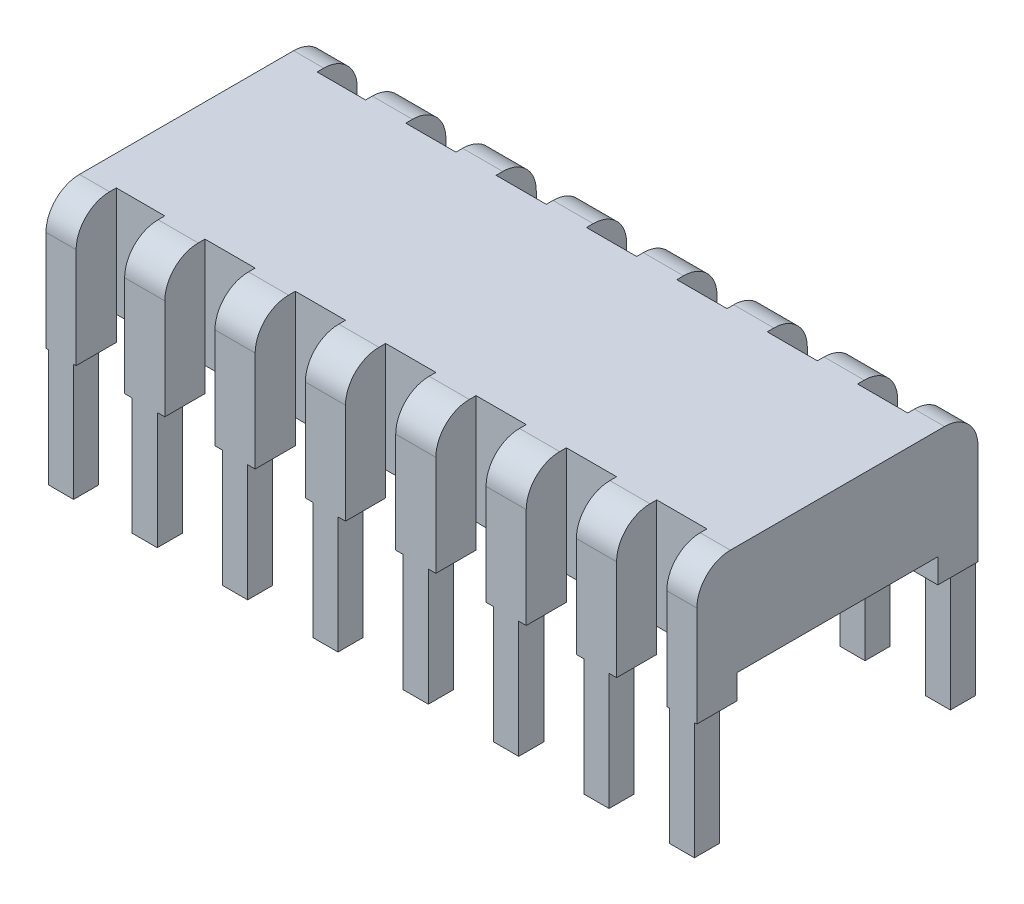
from build123d import *

# Parameters (mm, degrees)
SKETCH1_W           = 19.45
SKETCH1_H           = 6
BOSS_EXTRUDE1_DEPTH = 3.27
SKETCH2_W           = 0.9
SKETCH2_H           = 1.2
SKETCH2_W_2         = 1.2
BOSS_EXTRUDE2_DEPTH = 4
FILLET1_R           = 1
SKETCH3_W           = 0.75
SKETCH3_H           = 0.75
BOSS_EXTRUDE3_DEPTH = 3.5


with BuildPart() as part:
    # Sketch1 → Boss-Extrude1 (new body)
    with BuildSketch(Plane(origin=(0, 0, 0), x_dir=(1, 0, 0), z_dir=(0, 1, 0))):
        with Locations((9.725, 3)):
            Rectangle(SKETCH1_W, SKETCH1_H)
    extrude(amount=BOSS_EXTRUDE1_DEPTH)

    # Sketch2 → Boss-Extrude2 (add)
    with BuildSketch(Plane(origin=(0, 3.27, 0), x_dir=(1, 0, 0), z_dir=(0, 1, 0))):
        with Locations((19, -0.6)):
            Rectangle(SKETCH2_W, SKETCH2_H)
        with Locations((16.45, -0.6)):
            Rectangle(SKETCH2_W_2, SKETCH2_H)
        with Locations((13.75, -0.6)):
            Rectangle(SKETCH2_W_2, SKETCH2_H)
        with Locations((11.05, -0.6)):
            Rectangle(SKETCH2_W_2, SKETCH2_H)
        with Locations((8.35, -0.6)):
            Rectangle(SKETCH2_W_2, SKETCH2_H)
        with Locations((5.65, -0.6)):
            Rectangle(SKETCH2_W_2, SKETCH2_H)
        with Locations((2.95, -0.6)):
            Rectangle(SKETCH2_W_2, SKETCH2_H)
        with Locations((0.45, -0.6)):
            Rectangle(SKETCH2_W, SKETCH2_H)
        with Locations((0.45, 6.6)):
            Rectangle(SKETCH2_W, SKETCH2_H)
        with Locations((2.95, 6.6)):
            Rectangle(SKETCH2_W_2, SKETCH2_H)
        with Locations((5.65, 6.6)):
            Rectangle(SKETCH2_W_2, SKETCH2_H)
        with Locations((8.35, 6.6)):
            Rectangle(SKETCH2_W_2, SKETCH2_H)
        with Locations((11.05, 6.6)):
            Rectangle(SKETCH2_W_2, SKETCH2_H)
        with Locations((13.75, 6.6)):
            Rectangle(SKETCH2_W_2, SKETCH2_H)
        with Locations((16.45, 6.6)):
            Rectangle(SKETCH2_W_2, SKETCH2_H)
        with Locations((19, 6.6)):
            Rectangle(SKETCH2_W, SKETCH2_H)
    extrude(amount=-BOSS_EXTRUDE2_DEPTH)

    # Fillet1
    fillet1_edges = [part.edges().sort_by_distance(p)[0] for p in [
        (0.45, 3.27, 1.2),
        (0.45, 3.27, -7.2),
        (2.95, 3.27, -7.2),
        (5.65, 3.27, -7.2),
        (8.35, 3.27, -7.2),
        (19, 3.27, 1.2),
        (11.05, 3.27, -7.2),
        (13.75, 3.27, -7.2),
        (16.45, 3.27, -7.2),
        (19, 3.27, -7.2),
        (16.45, 3.27, 1.2),
        (13.75, 3.27, 1.2),
        (11.05, 3.27, 1.2),
        (8.35, 3.27, 1.2),
        (5.65, 3.27, 1.2),
        (2.95, 3.27, 1.2),
    ]]
    fillet(fillet1_edges, radius=FILLET1_R)

    # Sketch3 → Boss-Extrude3 (add)
    with BuildSketch(Plane.XZ.offset(0.73)):
        with Locations((19, 0.825)):
            Rectangle(SKETCH3_W, SKETCH3_H)
        with Locations((16.45, 0.825)):
            Rectangle(SKETCH3_W, SKETCH3_H)
        with Locations((13.75, 0.825)):
            Rectangle(SKETCH3_W, SKETCH3_H)
        with Locations((11.05, 0.825)):
            Rectangle(SKETCH3_W, SKETCH3_H)
        with Locations((8.35, 0.825)):
            Rectangle(SKETCH3_W, SKETCH3_H)
        with Locations((5.65, 0.825)):
            Rectangle(SKETCH3_W, SKETCH3_H)
        with Locations((2.95, 0.825)):
            Rectangle(SKETCH3_W, SKETCH3_H)
        with Locations((0.45, 0.825)):
            Rectangle(SKETCH3_W, SKETCH3_H)
        with Locations((0.45, -6.825)):
            Rectangle(SKETCH3_W, SKETCH3_H)
        with Locations((2.95, -6.825)):
            Rectangle(SKETCH3_W, SKETCH3_H)
        with Locations((5.65, -6.825)):
            Rectangle(SKETCH3_W, SKETCH3_H)
        with Locations((11.05, -6.825)):
            Rectangle(SKETCH3_W, SKETCH3_H)
        with Locations((8.35, -6.825)):
            Rectangle(SKETCH3_W, SKETCH3_H)
        with Locations((13.75, -6.825)):
            Rectangle(SKETCH3_W, SKETCH3_H)
        with Locations((16.45, -6.825)):
            Rectangle(SKETCH3_W, SKETCH3_H)
        with Locations((19, -6.825)):
            Rectangle(SKETCH3_W, SKETCH3_H)
    extrude(amount=BOSS_EXTRUDE3_DEPTH)


solid = part.part
